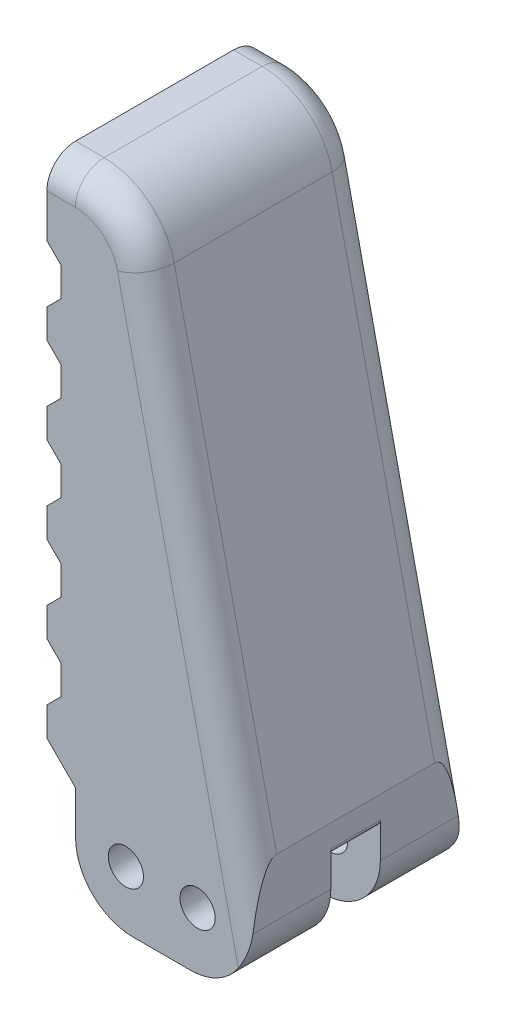
from build123d import *

# Parameters (mm, degrees)
SKETCH1_R                       = 1.225
BOSS_EXTRUDE1_DEPTH             = 7.5
CUT_EXTRUDE2_DEPTH              = 1.725
BOSS_EXTRUDE3_REACH             = 43.137
BOSS_EXTRUDE3_DIRECTION_2_REACH = 43.137
FILLET5_R                       = 5
FILLET6_R                       = 4
FILLET7_R                       = 2
FILLET8_R                       = 0.4


with BuildPart() as part:
    # Sketch1 → Boss-Extrude1 (new, symmetric)
    with BuildSketch(Plane.XY):
        Polygon((-6, -4), (6, -4), (6, 4), (-2, 40), (-6, 40), align=None)
        with Locations((-2.5, 0)):
            Circle(SKETCH1_R, mode=Mode.SUBTRACT)
        with Locations((2.5, 0)):
            Circle(SKETCH1_R, mode=Mode.SUBTRACT)
    extrude(amount=BOSS_EXTRUDE1_DEPTH, both=True)

    # Sketch4 → Cut-Extrude2 (cut, symmetric)
    with BuildSketch(Plane.XY):
        with BuildLine():
            Line((-3.05, 3), (3.05, 3))
            ThreePointArc((3.05, 3), (5.489518395, 1.989518395), (6.5, -0.45))
            Line((6.5, -0.45), (6.5, -4))
            Line((6.5, -4), (-6.5, -4))
            Line((-6.5, -4), (-6.5, -0.45))
            ThreePointArc((-6.5, -0.45), (-5.489518395, 1.989518395), (-3.05, 3))
        make_face()
    extrude(amount=CUT_EXTRUDE2_DEPTH, both=True, mode=Mode.SUBTRACT)

    # Boss-Extrude3: up to this face of the body (flat: up to its plane)
    boss_extrude3_end = Plane(part.part.faces().sort_by_distance((-1.281464988, 14.60870086, 7.5))[0])
    # Sketch6 → Boss-Extrude3 (add, up to the picked face)
    with BuildSketch(Plane.XY, mode=Mode.PRIVATE) as boss_extrude3_sk1:
        Polygon((-6, 40), (-6, 3), (-8, 5), (-8, 7), (-7, 8), (-7, 10), (-8, 11), (-8, 13), (-7, 14), (-7, 16), (-8, 17), (-8, 19), (-7, 20), (-7, 22), (-8, 23), (-8, 25), (-7, 26), (-7, 28), (-8, 29), (-8, 31), (-7, 32), (-7, 34), (-8, 35), (-8, 40), align=None)
    boss_extrude3_tool1 = split(extrude(boss_extrude3_sk1.sketch, amount=BOSS_EXTRUDE3_REACH, mode=Mode.PRIVATE), bisect_by=boss_extrude3_end, keep=Keep.BOTH, mode=Mode.PRIVATE)
    add(boss_extrude3_tool1.solids().sort_by(Axis((-6.842105, 22.25731, 0), (0, 0, 1)))[0])

    # Boss-Extrude3 direction 2: up to this face of the body (flat: up to its plane)
    boss_extrude3_direction_2_end = Plane(part.part.faces().sort_by_distance((-1.281464988, 14.60870086, -7.5))[0])
    # Sketch6 → Boss-Extrude3 direction 2 (add, up to the picked face)
    with BuildSketch(Plane.XY, mode=Mode.PRIVATE) as boss_extrude3_direction_2_sk1:
        Polygon((-6, 40), (-6, 3), (-8, 5), (-8, 7), (-7, 8), (-7, 10), (-8, 11), (-8, 13), (-7, 14), (-7, 16), (-8, 17), (-8, 19), (-7, 20), (-7, 22), (-8, 23), (-8, 25), (-7, 26), (-7, 28), (-8, 29), (-8, 31), (-7, 32), (-7, 34), (-8, 35), (-8, 40), align=None)
    boss_extrude3_direction_2_tool1 = split(extrude(boss_extrude3_direction_2_sk1.sketch, amount=-BOSS_EXTRUDE3_DIRECTION_2_REACH, mode=Mode.PRIVATE), bisect_by=boss_extrude3_direction_2_end, keep=Keep.BOTH, mode=Mode.PRIVATE)
    add(boss_extrude3_direction_2_tool1.solids().sort_by(Axis((-6.842105, 22.25731, 0), (0, 0, -1)))[0])

    # Fillet5
    fillet5_edges = [part.edges().sort_by_distance(p)[0] for p in [
        (-2, 40, 0),
    ]]
    fillet(fillet5_edges, radius=FILLET5_R)

    # Fillet6
    fillet6_edges = [part.edges().sort_by_distance(p)[0] for p in [
        (6, -4, -4.6125),
        (6, -4, 4.6125),
        (-6, -4, -4.6125),
        (-6, -4, 4.6125),
    ]]
    fillet(fillet6_edges, radius=FILLET6_R)

    # Fillet7
    fillet7_edges = [part.edges().sort_by_distance(p)[0] for p in [
        (-2.882221064, 38.900209061, -7.5),
        (-2.882221064, 38.900209061, 7.5),
        (2.435038635, 20.042326145, -7.5),
        (2.435038635, 20.042326145, 7.5),
        (-7.005429016, 40, -7.5),
        (-7.005429016, 40, 7.5),
    ]]
    fillet(fillet7_edges, radius=FILLET7_R)

    # Fillet8
    fillet8_edges = [part.edges().sort_by_distance(p)[0] for p in [
        (6, 1.338854382, 0),
        (-6, 1.338854382, 0),
    ]]
    fillet(fillet8_edges, radius=FILLET8_R)


solid = part.part
